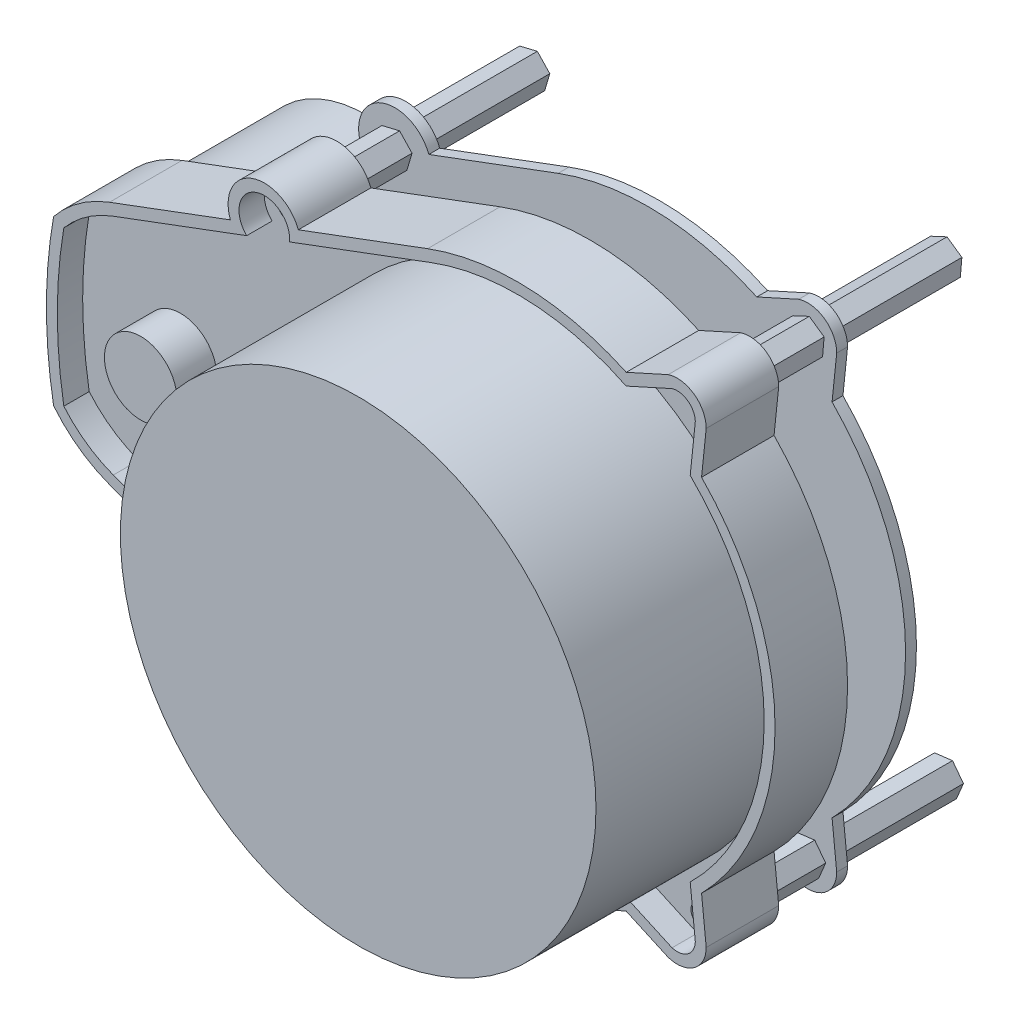
from build123d import *

# Parameters (mm, degrees)
ESQUISSE1_R             = 1.6
BOSS_EXTRU_1_DEPTH      = 10
ESQUISSE2_R             = 32.8
BOSS_EXTRU_2_DEPTH      = 22
ENL_V_MAT_EXTRU_1_DEPTH = 3.5
BOSS_EXTRU_3_REACH      = 79.261
ESQUISSE4_R             = 32.8
ESQUISSE5_R             = 16
BOSS_EXTRU_4_DEPTH      = 19
ESQUISSE6_R             = 1
BOSS_EXTRU_5_DEPTH      = 27
BOSS_EXTRU_6_DEPTH      = 1.5
ESQUISSE8_R             = 5
BOSS_EXTRU_7_DEPTH      = 5.5


with BuildPart() as part:
    # Esquisse1 → Boss.-Extru.1 (new body)
    with BuildSketch(Plane.XY):
        with BuildLine():
            ThreePointArc((-56.3, -16.861494596), (-60.528670487, -14.599558136), (-64.01, -11.301322931))
            ThreePointArc((-64.01, -11.301322931), (-65, 0), (-64.01, 11.301322931))
            ThreePointArc((-64.01, 11.301322931), (-60.528670487, 14.599558136), (-56.3, 16.861494596))
            Line((-56.3, 16.861494596), (-39.624688626, 23.091930519))
            ThreePointArc((-39.624688626, 23.091930519), (-36.690940127, 29.525679018), (-30.257191628, 26.591930519))
            Line((-30.257191628, 26.591930519), (-12.425, 33.254614341))
            ThreePointArc((-12.425, 33.254614341), (1.381675102, 35.473102119), (14.973963383, 32.187426436))
            Line((14.973963383, 32.187426436), (20.756023105, 34.801647207))
            ThreePointArc((20.756023105, 34.801647207), (24.347774736, 34.238511045), (26, 31))
            Line((26, 31), (25.359978077, 24.841930519))
            ThreePointArc((25.359978077, 24.841930519), (35.5, 0), (25.359978077, -24.841930519))
            Line((25.359978077, -24.841930519), (26, -31))
            ThreePointArc((26, -31), (24.347774736, -34.238511045), (20.756023105, -34.801647207))
            Line((20.756023105, -34.801647207), (14.973963383, -32.187426436))
            ThreePointArc((14.973963383, -32.187426436), (1.381675102, -35.473102119), (-12.425, -33.254614341))
            Line((-12.425, -33.254614341), (-30.257191628, -26.591930519))
            ThreePointArc((-30.257191628, -26.591930519), (-36.690940127, -29.525679018), (-39.624688626, -23.091930519))
            Line((-39.624688626, -23.091930519), (-56.3, -16.861494596))
        make_face()
        with Locations((-35, -25)):
            Circle(ESQUISSE1_R, mode=Mode.SUBTRACT)
        with Locations((22, 31)):
            Circle(ESQUISSE1_R, mode=Mode.SUBTRACT)
        with Locations((-35, 25)):
            Circle(ESQUISSE1_R, mode=Mode.SUBTRACT)
        with Locations((22, -31)):
            Circle(ESQUISSE1_R, mode=Mode.SUBTRACT)
    extrude(amount=BOSS_EXTRU_1_DEPTH)

    # Esquisse2 → Boss.-Extru.2 (add)
    with BuildSketch(Plane.XY.offset(10)):
        Circle(ESQUISSE2_R)
    extrude(amount=BOSS_EXTRU_2_DEPTH)

    # Esquisse3 → Enlèv. mat.-Extru.1 (cut)
    with BuildSketch(Plane.XY.offset(10)):
        with BuildLine():
            Line((-55.775, -15.456370046), (-37.378202776, -22.330008789))
            ThreePointArc((-37.378202776, -22.330008789), (-36.165940127, -28.120554469), (-31.453677478, -24.543603151))
            Line((-31.453677478, -24.543603151), (-11.9, -31.849489792))
            ThreePointArc((-11.9, -31.849489792), (1.664031028, -33.959255009), (14.956816294, -30.533484019))
            Line((14.956816294, -30.533484019), (21.291141631, -33.397398551))
            ThreePointArc((21.291141631, -33.397398551), (23.468656713, -33.023128137), (24.499056843, -31.06866508))
            Line((24.499056843, -31.06866508), (23.79417774, -24.286562245))
            ThreePointArc((23.79417774, -24.286562245), (34, 0), (23.79417774, 24.286562245))
            Line((23.79417774, 24.286562245), (24.499056843, 31.06866508))
            ThreePointArc((24.499056843, 31.06866508), (23.468656713, 33.023128137), (21.291141631, 33.397398551))
            Line((21.291141631, 33.397398551), (14.956816294, 30.533484019))
            ThreePointArc((14.956816294, 30.533484019), (1.664031028, 33.959255009), (-11.9, 31.849489792))
            Line((-11.9, 31.849489792), (-31.453677478, 24.543603151))
            ThreePointArc((-31.453677478, 24.543603151), (-36.165940127, 28.120554469), (-37.378202776, 22.330008789))
            Line((-37.378202776, 22.330008789), (-55.775, 15.456370046))
            ThreePointArc((-55.775, 15.456370046), (-59.496201473, 13.493411636), (-62.6, 10.653168543))
            ThreePointArc((-62.6, 10.653168543), (-63.5, 0), (-62.6, -10.653168543))
            ThreePointArc((-62.6, -10.653168543), (-59.496201473, -13.493411636), (-55.775, -15.456370046))
        make_face()
    extrude(amount=-ENL_V_MAT_EXTRU_1_DEPTH, mode=Mode.SUBTRACT)


with BuildPart() as enl_v_mat_extru_1_piece_1:
    # of the separate pieces the step leaves, piece 1, a body of its own (enl_v_mat_extru_1_pieces)
    add(part.part.solids().sort_by_distance((32.8, 0, 10))[0])


with BuildPart() as enl_v_mat_extru_1_piece_2:
    # of the separate pieces the step leaves, piece 2, a body of its own (enl_v_mat_extru_1_pieces)
    add(part.part.solids().sort_by_distance((-64.01, 11.301322931, 0))[0])

    # Esquisse4 → Boss.-Extru.3 (add, up to next)
    with BuildSketch(Plane(origin=(0, 0, 10), x_dir=(-1, 0, 0), z_dir=(0, 0, -1)), mode=Mode.PRIVATE) as boss_extru_3_sk1:
        with Locations(Location((0, 0, 0), (0, 0, 180))):
            Circle(ESQUISSE4_R)
    boss_extru_3_tool1 = extrude(boss_extru_3_sk1.sketch, amount=BOSS_EXTRU_3_REACH, mode=Mode.PRIVATE) - enl_v_mat_extru_1_piece_2.part

    add(enl_v_mat_extru_1_piece_1.part)  # Boss.-Extru.3 merges Enlèv. mat.-Extru.1 piece 1
    add(boss_extru_3_tool1.solids().sort_by_distance((0, 0, 10))[0])

    # Esquisse5 → Boss.-Extru.4 (add)
    with BuildSketch(Plane(origin=(0, 0, 0), x_dir=(-1, 0, 0), z_dir=(0, 0, -1))):
        with Locations(Location((50, 0, 0), (0, 0, 336.653490915))):
            Circle(ESQUISSE5_R)
    extrude(amount=BOSS_EXTRU_4_DEPTH)

    # Esquisse6 → Boss.-Extru.5 (add)
    # profile 1 of 4: a face of its own
    with BuildSketch(Plane(origin=(0, 0, 0), x_dir=(-1, 0, 0), z_dir=(0, 0, -1))):
        Polygon((-20.489225606, -29.008126327), (-22.969626005, -28.695694159), (-24.480400399, -30.687567832), (-23.510774394, -32.991873673), (-21.030373995, -33.304305841), (-19.519599601, -31.312432168), align=None)
        with Locations((-22, -31)):
            Circle(ESQUISSE6_R, mode=Mode.SUBTRACT)
    # profile 2 of 4: a face of its own
    with BuildSketch(Plane(origin=(0, 0, 0), x_dir=(-1, 0, 0), z_dir=(0, 0, -1))):
        Polygon((36.086835018, -22.748602735), (33.593650283, -22.933074633), (32.506815266, -25.184471898), (33.913164982, -27.251397265), (36.406349717, -27.066925367), (37.493184734, -24.815528102), align=None)
        with Locations((35, -25)):
            Circle(ESQUISSE6_R, mode=Mode.SUBTRACT)
    # profile 3 of 4: a face of its own
    with BuildSketch(Plane(origin=(0, 0, 0), x_dir=(-1, 0, 0), z_dir=(0, 0, -1))):
        Polygon((36.720274889, 26.814016072), (34.289153443, 27.396809791), (32.568878555, 25.582793719), (33.279725111, 23.185983928), (35.710846557, 22.603190209), (37.431121445, 24.417206281), align=None)
        with Locations((35, 25)):
            Circle(ESQUISSE6_R, mode=Mode.SUBTRACT)
    # profile 4 of 4: a face of its own
    with BuildSketch(Plane(origin=(0, 0, 0), x_dir=(-1, 0, 0), z_dir=(0, 0, -1))):
        Polygon((-19.952160425, 32.43399898), (-22.217959758, 33.490480585), (-24.265799333, 32.056481605), (-24.047839575, 29.56600102), (-21.782040242, 28.509519415), (-19.734200667, 29.943518395), align=None)
        with Locations((-22, 31)):
            Circle(ESQUISSE6_R, mode=Mode.SUBTRACT)
    extrude(amount=BOSS_EXTRU_5_DEPTH)

    # Esquisse7 → Boss.-Extru.6 (add)
    with BuildSketch(Plane(origin=(0, 0, -8), x_dir=(-1, 0, 0), z_dir=(0, 0, -1))):
        with BuildLine():
            Line((30.257191628, 26.591930519), (12.425, 33.254614341))
            ThreePointArc((12.425, 33.254614341), (-1.381675102, 35.473102119), (-14.973963383, 32.187426436))
            Line((-14.973963383, 32.187426436), (-20.756023105, 34.801647207))
            ThreePointArc((-20.756023105, 34.801647207), (-24.347774736, 34.238511045), (-26, 31))
            Line((-26, 31), (-25.359978077, 24.841930519))
            ThreePointArc((-25.359978077, 24.841930519), (-35.5, 0), (-25.359978077, -24.841930519))
            Line((-25.359978077, -24.841930519), (-26, -31))
            ThreePointArc((-26, -31), (-24.347774736, -34.238511045), (-20.756023105, -34.801647207))
            Line((-20.756023105, -34.801647207), (-14.973963383, -32.187426436))
            ThreePointArc((-14.973963383, -32.187426436), (-1.381675102, -35.473102119), (12.425, -33.254614341))
            Line((12.425, -33.254614341), (30.257191628, -26.591930519))
            ThreePointArc((30.257191628, -26.591930519), (36.690940127, -29.525679018), (39.624688626, -23.091930519))
            ThreePointArc((39.624688626, -23.091930519), (33.487603548, 0), (39.624688626, 23.091930519))
            ThreePointArc((39.624688626, 23.091930519), (36.690940127, 29.525679018), (30.257191628, 26.591930519))
        make_face()
    extrude(amount=BOSS_EXTRU_6_DEPTH)

    # Esquisse8 → Boss.-Extru.7 (add)
    with BuildSketch(Plane.XY.offset(6.5)):
        with Locations((-50, 0)):
            Circle(ESQUISSE8_R)
    extrude(amount=BOSS_EXTRU_7_DEPTH)


solid = enl_v_mat_extru_1_piece_2.part
